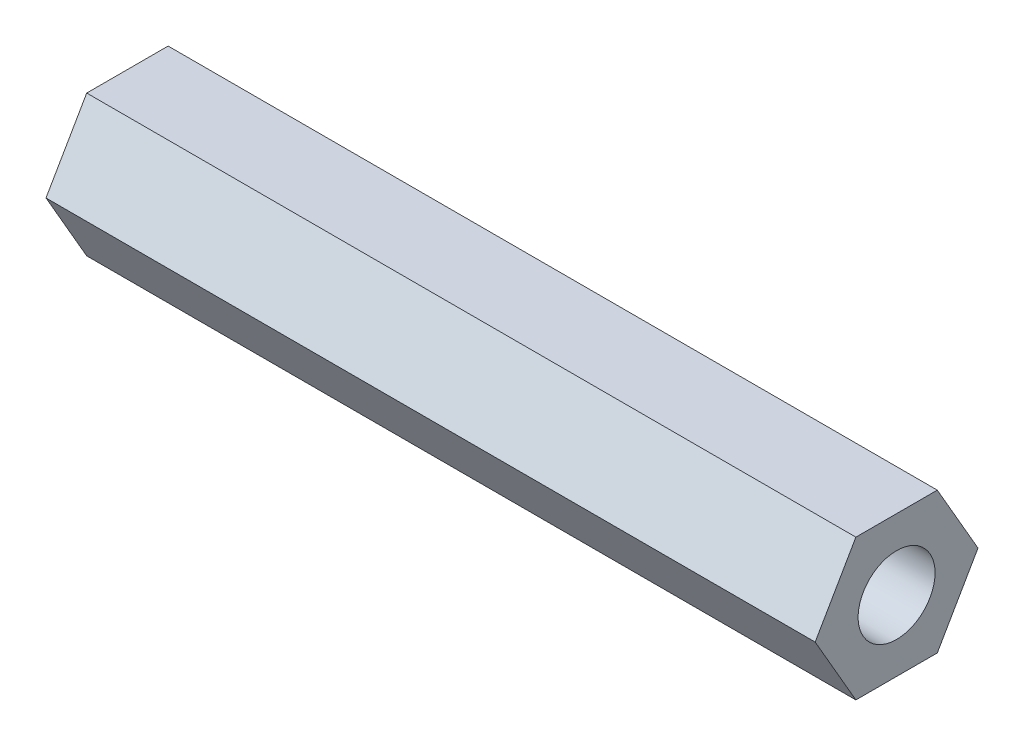
from build123d import *

# Parameters (mm, degrees)
HEX_2_DEPTH   = 30
BORE_SKETCH_W = 32
BORE_SKETCH_H = 1.5


with BuildPart() as part:
    # Hex Sketch → Hex 2 (new body)
    with BuildSketch(Plane(origin=(0, 0, 0), x_dir=(0, 0, -1), z_dir=(1, 0, 0))):
        Polygon((3.175426481, 0), (1.58771324, 2.75), (-1.58771324, 2.75), (-3.175426481, 0), (-1.58771324, -2.75), (1.58771324, -2.75), align=None)
    extrude(amount=HEX_2_DEPTH)

    # Bore Sketch → Bore (revolve, cut)
    with BuildSketch(Plane.XY):
        with Locations((15, 0.75)):
            Rectangle(BORE_SKETCH_W, BORE_SKETCH_H)
    revolve(axis=Axis((-400, 0, 0), (1, 0, 0)), mode=Mode.SUBTRACT)


solid = part.part
